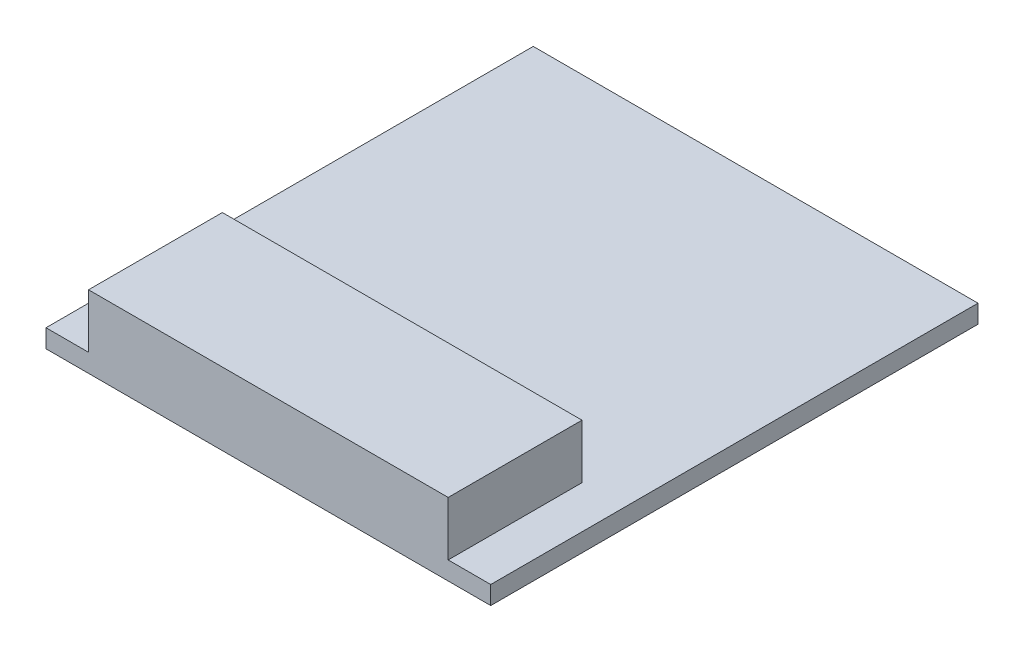
from build123d import *

# Parameters (mm, degrees)
SKETCH1_W           = 14.605
SKETCH1_H           = 16.002
BOSS_EXTRUDE1_DEPTH = 0.6
SKETCH2_W           = 11.811
SKETCH2_H           = 4.3942
BOSS_EXTRUDE2_DEPTH = 1.778


with BuildPart() as part:
    # Sketch1 → Boss-Extrude1 (new body)
    with BuildSketch(Plane(origin=(0, 0, 0), x_dir=(1, 0, 0), z_dir=(0, 1, 0))):
        with Locations((2.6975, 6.499)):
            Rectangle(SKETCH1_W, SKETCH1_H)
    extrude(amount=BOSS_EXTRUDE1_DEPTH)

    # Sketch2 → Boss-Extrude2 (add)
    with BuildSketch(Plane(origin=(0, 0.6, 0), x_dir=(1, 0, 0), z_dir=(0, 1, 0))):
        with Locations((2.6975, 0.6951)):
            Rectangle(SKETCH2_W, SKETCH2_H)
    extrude(amount=BOSS_EXTRUDE2_DEPTH)


solid = part.part
